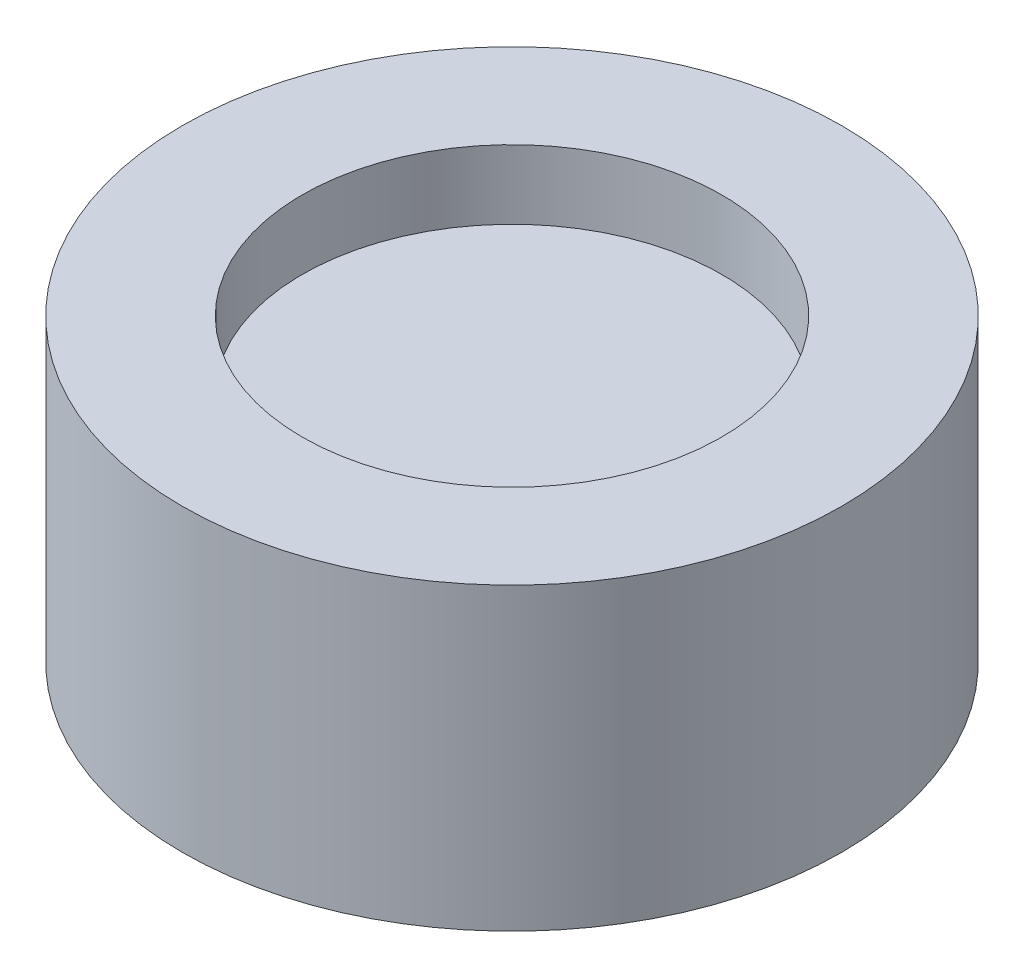
from build123d import *

# Parameters (mm, degrees)
SKETCH_1_R          = 11
EXTRUDE_1_DEPTH     = 10
SKETCH_2_R          = 7
CUT_EXTRUDE_1_DEPTH = 2.3


with BuildPart() as part:
    # 草图1 → 凸台-拉伸1 (new body)
    with BuildSketch(Plane(origin=(0, 0, 0), x_dir=(1, 0, 0), z_dir=(0, 1, 0))):
        with Locations(Location((0, 0, 0), (0, 0, 270))):
            Circle(SKETCH_1_R)
    extrude(amount=EXTRUDE_1_DEPTH)

    # 草图2 → 切除-拉伸1 (cut)
    with BuildSketch(Plane(origin=(0, 10, 0), x_dir=(1, 0, 0), z_dir=(0, 1, 0))):
        with Locations(Location((0, 0, 0), (0, 0, 270))):
            Circle(SKETCH_2_R)
    extrude(amount=-CUT_EXTRUDE_1_DEPTH, mode=Mode.SUBTRACT)


solid = part.part
